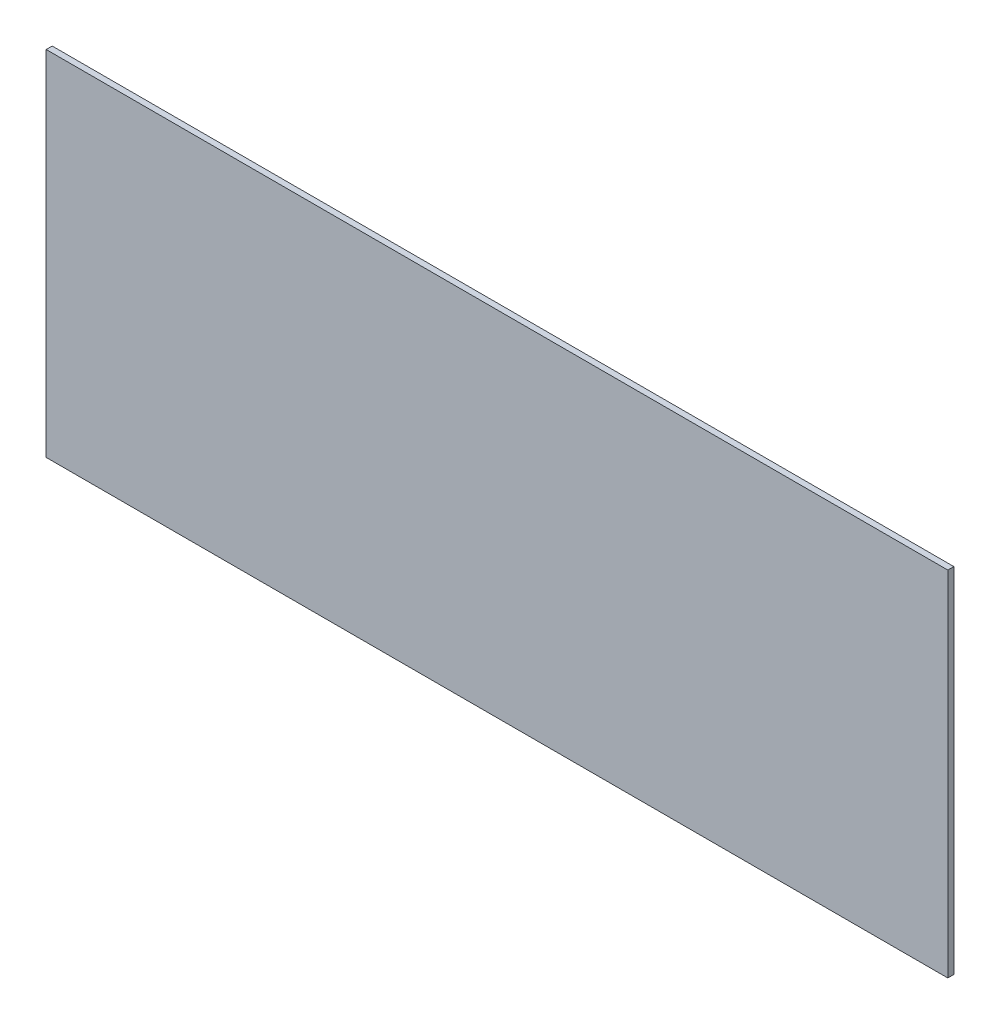
from build123d import *

# Parameters (mm, degrees)
ESQUISSE1_W        = 747
ESQUISSE1_H        = 292.7
BOSS_EXTRU_1_DEPTH = 5


with BuildPart() as part:
    # Esquisse1 → Boss.-Extru.1 (new body)
    with BuildSketch(Plane.XY):
        Rectangle(ESQUISSE1_W, ESQUISSE1_H)
    extrude(amount=BOSS_EXTRU_1_DEPTH)


solid = part.part
